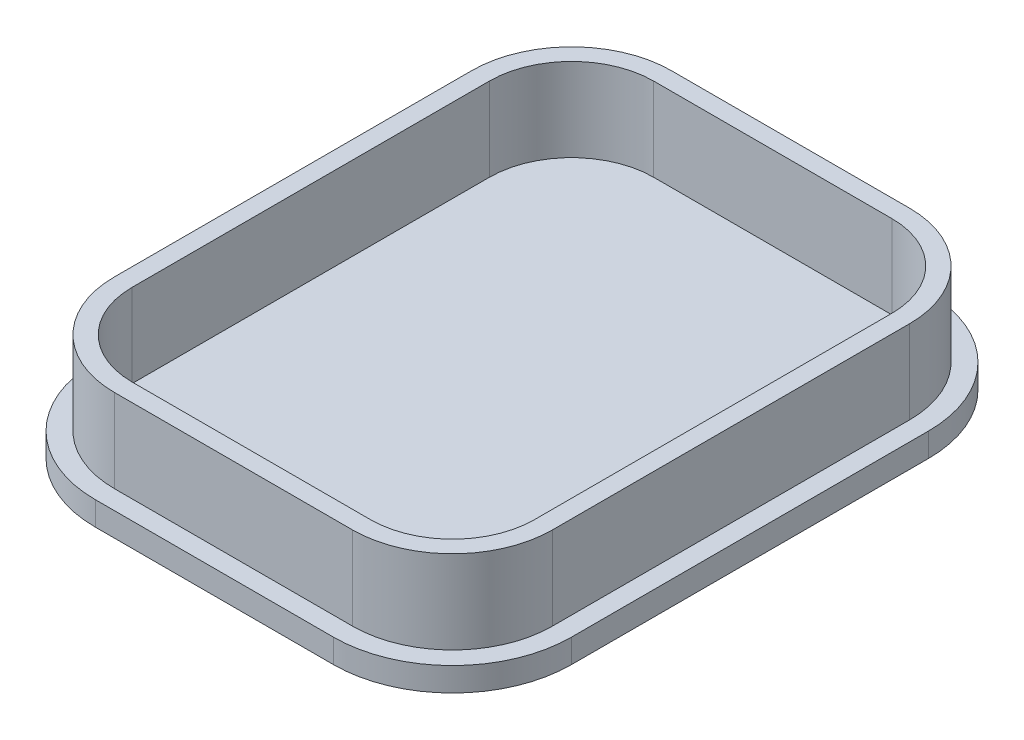
from build123d import *

# Parameters (mm, degrees)
RESSALTO_EXTRUS_O1_DEPTH = 2
RESSALTO_EXTRUS_O2_DEPTH = 7


with BuildPart() as part:
    # Esboço1 → Ressalto-extrusão1 (new body)
    with BuildSketch(Plane(origin=(0, 0, 0), x_dir=(1, 0, 0), z_dir=(0, 1, 0))):
        with BuildLine():
            Line((-10.348817595, -24.761398547), (9.651182405, -24.761398547))
            ThreePointArc((9.651182405, -24.761398547), (16.722250217, -21.832466359), (19.651182405, -14.761398547))
            Line((19.651182405, -14.761398547), (19.651182405, 15.238601453))
            ThreePointArc((19.651182405, 15.238601453), (16.722250217, 22.309669265), (9.651182405, 25.238601453))
            Line((9.651182405, 25.238601453), (-10.348817595, 25.238601453))
            ThreePointArc((-10.348817595, 25.238601453), (-17.419885407, 22.309669265), (-20.348817595, 15.238601453))
            Line((-20.348817595, 15.238601453), (-20.348817595, -14.761398547))
            ThreePointArc((-20.348817595, -14.761398547), (-17.419885407, -21.832466359), (-10.348817595, -24.761398547))
        make_face()
    extrude(amount=RESSALTO_EXTRUS_O1_DEPTH)

    # Esboço2 → Ressalto-extrusão2 (add)
    with BuildSketch(Plane(origin=(0, 2, 0), x_dir=(1, 0, 0), z_dir=(0, 1, 0))):
        with BuildLine():
            Line((-18.748817595, 15.238601453), (-18.748817595, -14.761398547))
            ThreePointArc((-18.748817595, -14.761398547), (-16.288514557, -20.701095509), (-10.348817595, -23.161398547))
            Line((-10.348817595, -23.161398547), (9.651182405, -23.161398547))
            ThreePointArc((9.651182405, -23.161398547), (15.590879367, -20.701095509), (18.051182405, -14.761398547))
            Line((18.051182405, -14.761398547), (18.051182405, 15.238601453))
            ThreePointArc((18.051182405, 15.238601453), (15.590879367, 21.178298415), (9.651182405, 23.638601453))
            Line((9.651182405, 23.638601453), (-10.348817595, 23.638601453))
            ThreePointArc((-10.348817595, 23.638601453), (-16.288514557, 21.178298415), (-18.748817595, 15.238601453))
        make_face()
        with BuildLine():
            Line((-17.248817595, 15.238601453), (-17.248817595, -14.761398547))
            ThreePointArc((-17.248817595, -14.761398547), (-15.227854385, -19.640435337), (-10.348817595, -21.661398547))
            Line((-10.348817595, -21.661398547), (9.651182405, -21.661398547))
            ThreePointArc((9.651182405, -21.661398547), (14.530219195, -19.640435337), (16.551182405, -14.761398547))
            Line((16.551182405, -14.761398547), (16.551182405, 15.238601453))
            ThreePointArc((16.551182405, 15.238601453), (14.530219195, 20.117638244), (9.651182405, 22.138601453))
            Line((9.651182405, 22.138601453), (-10.348817595, 22.138601453))
            ThreePointArc((-10.348817595, 22.138601453), (-15.227854385, 20.117638244), (-17.248817595, 15.238601453))
        make_face(mode=Mode.SUBTRACT)
    extrude(amount=RESSALTO_EXTRUS_O2_DEPTH)


solid = part.part
